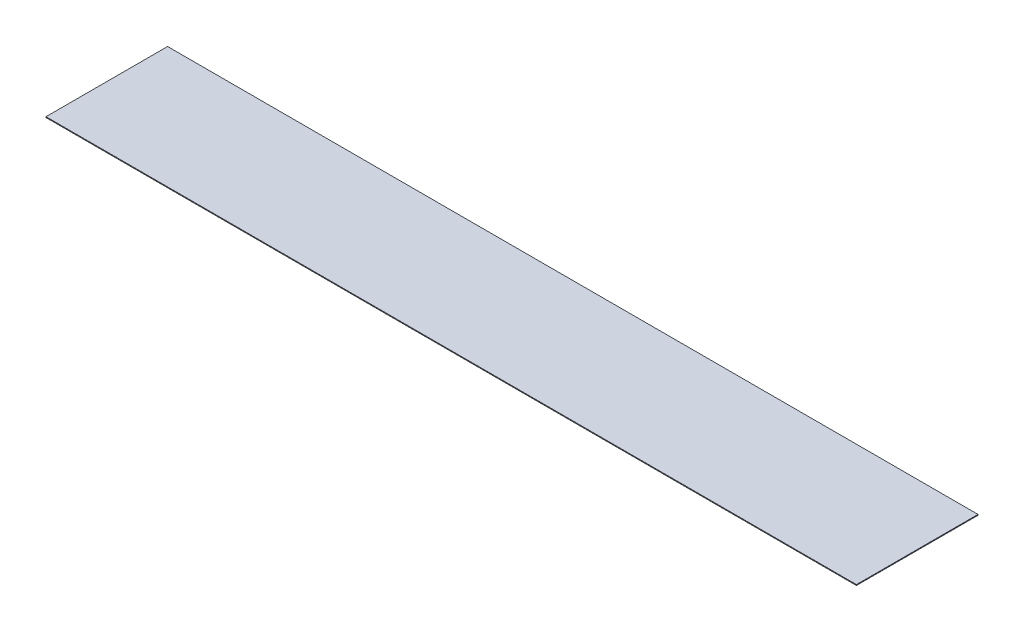
from build123d import *

# Parameters (mm, degrees)
SKETCH_1_W      = 1000
SKETCH_1_H      = 150
EXTRUDE_1_DEPTH = 1


with BuildPart() as part:
    # 草图1 → 凸台-拉伸1 (new body)
    with BuildSketch(Plane(origin=(0, 0, 0), x_dir=(1, 0, 0), z_dir=(0, 1, 0))):
        Rectangle(SKETCH_1_W, SKETCH_1_H)
    extrude(amount=EXTRUDE_1_DEPTH)


solid = part.part
